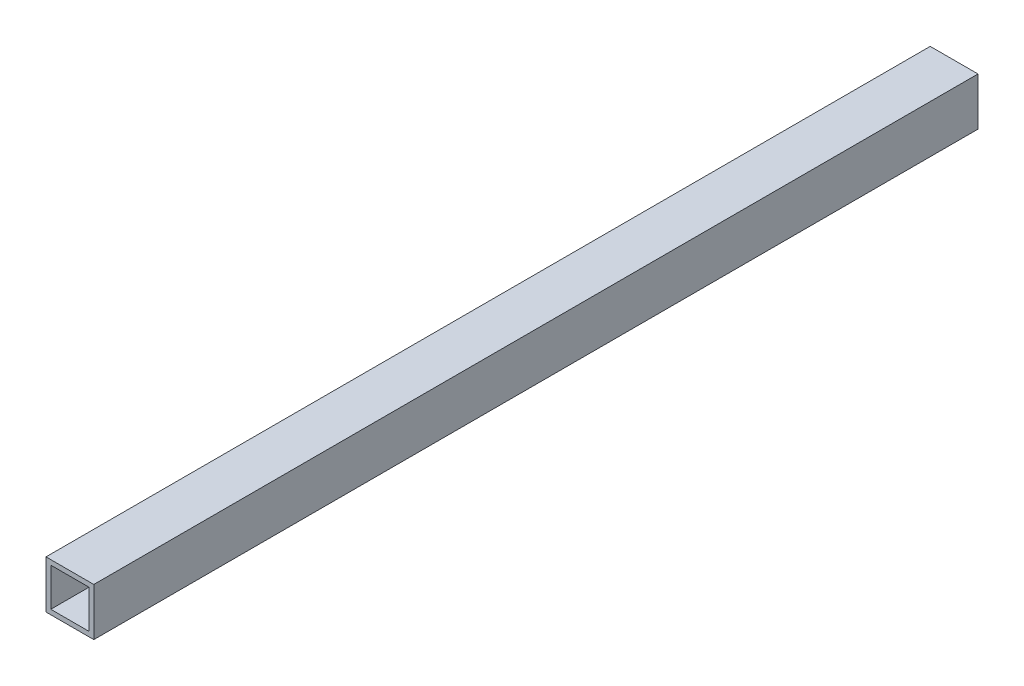
from build123d import *

# Parameters (mm, degrees)
SKETCH1_W           = 25.4
SKETCH1_H           = 25.4
SKETCH1_W_2         = 20.32
SKETCH1_H_2         = 20.32
BOSS_EXTRUDE1_DEPTH = 234.95


with BuildPart() as part:
    # Sketch1 → Boss-Extrude1 (new, symmetric)
    with BuildSketch(Plane.XY):
        Rectangle(SKETCH1_W, SKETCH1_H)
        Rectangle(SKETCH1_W_2, SKETCH1_H_2, mode=Mode.SUBTRACT)
    extrude(amount=BOSS_EXTRUDE1_DEPTH, both=True)


solid = part.part
